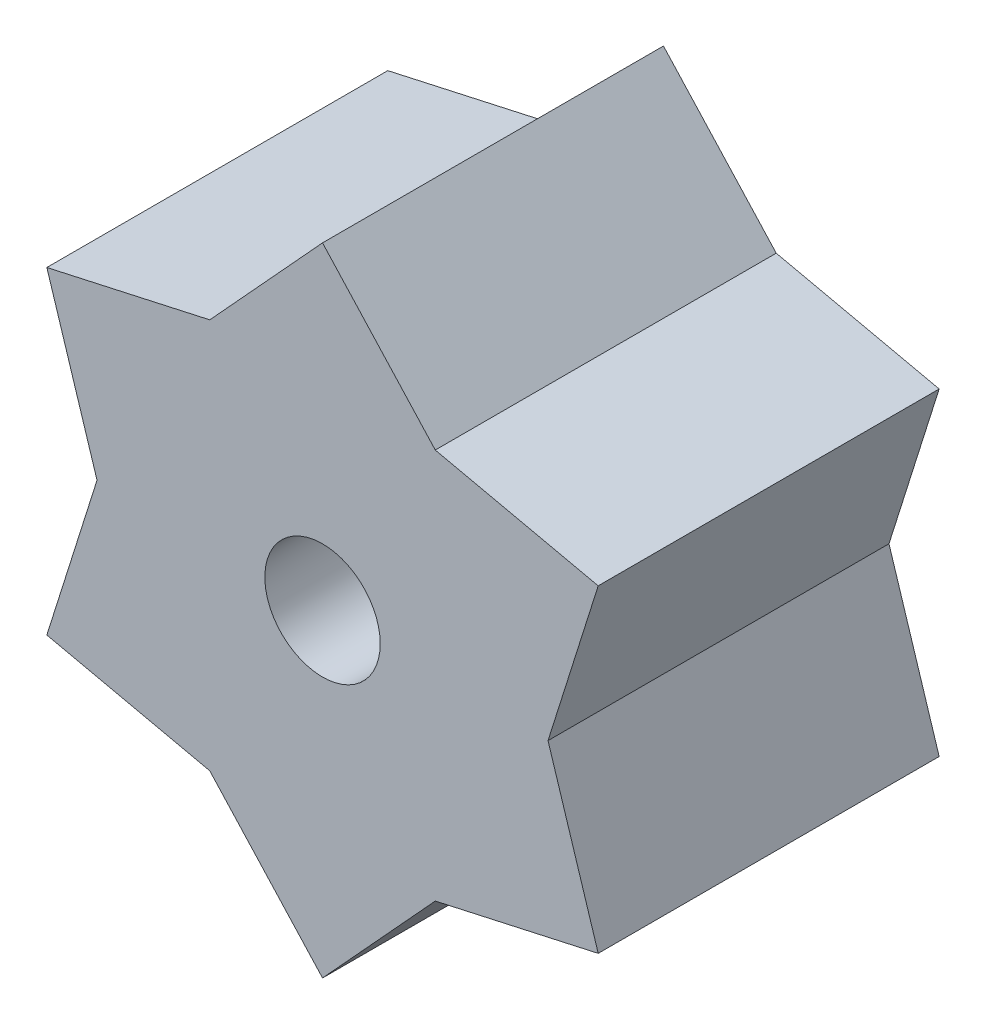
from build123d import *

# Parameters (mm, degrees)
SKETCH1_R           = 1.1
BOSS_EXTRUDE1_DEPTH = 6.5


with BuildPart() as part:
    # Sketch1 → Boss-Extrude1 (new body)
    with BuildSketch(Plane.XY):
        Polygon((0, -6.068767655), (2.149484707, -3.723016722), (5.255706959, -3.034383827), (4.298969413, 0), (5.255706959, 3.034383827), (2.149484707, 3.723016722), (0, 6.068767655), (-2.149484707, 3.723016722), (-5.255706959, 3.034383827), (-4.298969413, 0), (-5.255706959, -3.034383827), (-2.149484707, -3.723016722), align=None)
        Circle(SKETCH1_R, mode=Mode.SUBTRACT)
    extrude(amount=-BOSS_EXTRUDE1_DEPTH)


solid = part.part
